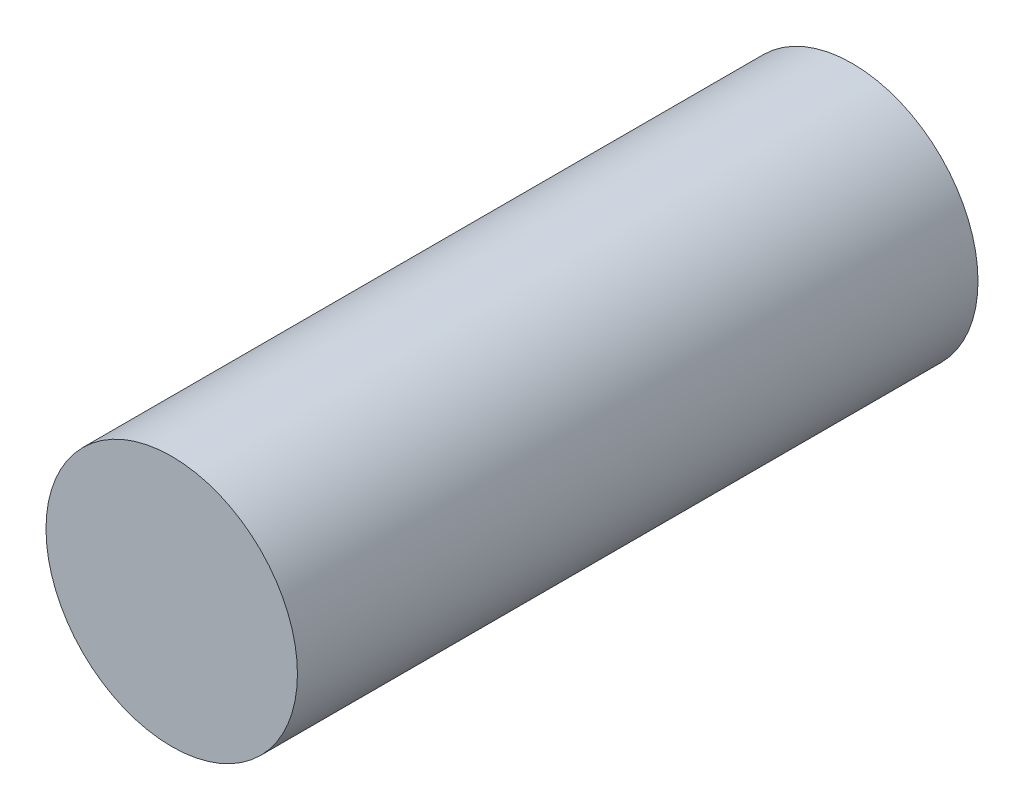
from build123d import *

# Parameters (mm, degrees)
SKETCH_1_R      = 0.75
EXTRUDE_1_DEPTH = 4.06


with BuildPart() as part:
    # 草图1 → 凸台-拉伸1 (new body)
    with BuildSketch(Plane.XY):
        Circle(SKETCH_1_R)
    extrude(amount=EXTRUDE_1_DEPTH)


solid = part.part
